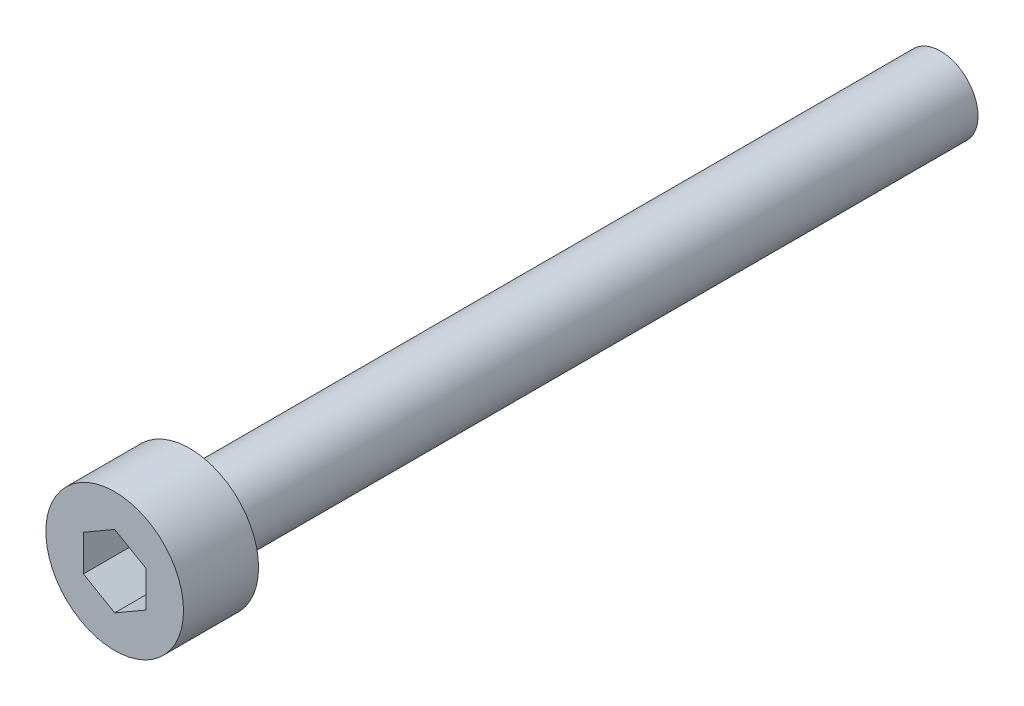
from build123d import *

# Parameters (mm, degrees)
THREAD_ENVELOPE_START = -30
PROFILE_1_R           = 1.5
THREAD_ENVELOPE_DEPTH = 30
PROFILE_2_R           = 2.75
SOCKET_HEAD_DEPTH     = 3


with BuildPart() as part:
    # Profile_1 → Thread_envelope (new body)
    with BuildSketch(Plane.XY.offset(THREAD_ENVELOPE_START)):
        Circle(PROFILE_1_R)
    extrude(amount=THREAD_ENVELOPE_DEPTH)

    # Profile_2 → Socket_head (add)
    with BuildSketch(Plane.XY):
        Circle(PROFILE_2_R)
        Polygon((1.25, 0.721687836), (0, 1.443375673), (-1.25, 0.721687836), (-1.25, -0.721687836), (0, -1.443375673), (1.25, -0.721687836), align=None, mode=Mode.SUBTRACT)
    extrude(amount=SOCKET_HEAD_DEPTH)


solid = part.part
